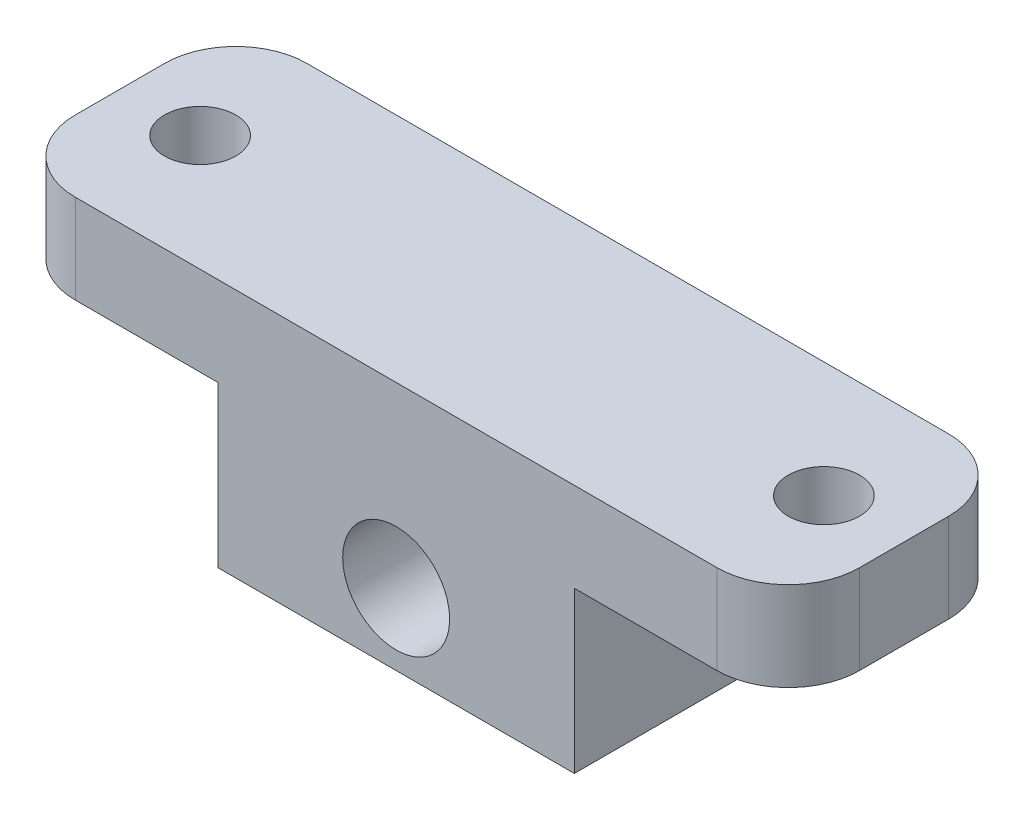
from build123d import *

# Parameters (mm, degrees)
SKETCH1_W           = 10
SKETCH1_H           = 4
SKETCH1_R           = 1.5
SKETCH1_H_2         = 3
BOSS_EXTRUDE1_DEPTH = 6.5
SKETCH12_W          = 22
SKETCH12_H          = 6.5
SKETCH12_R          = 1
BOSS_EXTRUDE2_DEPTH = 2.5
FILLET1_R           = 2


with BuildPart() as part:
    # Sketch1 → Boss-Extrude1 (new body)
    # profile 1 of 2: a face of its own
    with BuildSketch(Plane.XY):
        with Locations((0, 18.863386012)):
            Rectangle(SKETCH1_W, SKETCH1_H)
        with Locations(Location((0, 18.863386012, 0), (0, 0, 180))):
            Circle(SKETCH1_R, mode=Mode.SUBTRACT)
    # profile 2 of 2: a face of its own
    with BuildSketch(Plane.XY):
        with Locations((0, 22.363386012)):
            Rectangle(SKETCH1_W, SKETCH1_H_2)
    extrude(amount=BOSS_EXTRUDE1_DEPTH)

    # Sketch12 → Boss-Extrude2 (add)
    with BuildSketch(Plane(origin=(0, 23.863386012, 0), x_dir=(1, 0, 0), z_dir=(0, 1, 0))):
        with Locations((0, -3.25)):
            Rectangle(SKETCH12_W, SKETCH12_H)
        with Locations(Location((-8.75, -3.25, 0), (0, 0, 270))):
            Circle(SKETCH12_R, mode=Mode.SUBTRACT)
        with Locations(Location((8.75, -3.25, 0), (0, 0, 90))):
            Circle(SKETCH12_R, mode=Mode.SUBTRACT)
    extrude(amount=-BOSS_EXTRUDE2_DEPTH)

    # Fillet1
    fillet1_edges = [part.edges().sort_by_distance(p)[0] for p in [
        (-11, 22.613386012, 0),
        (11, 22.613386012, 0),
        (11, 22.613386012, 6.5),
        (-11, 22.613386012, 6.5),
    ]]
    fillet(fillet1_edges, radius=FILLET1_R)


solid = part.part
